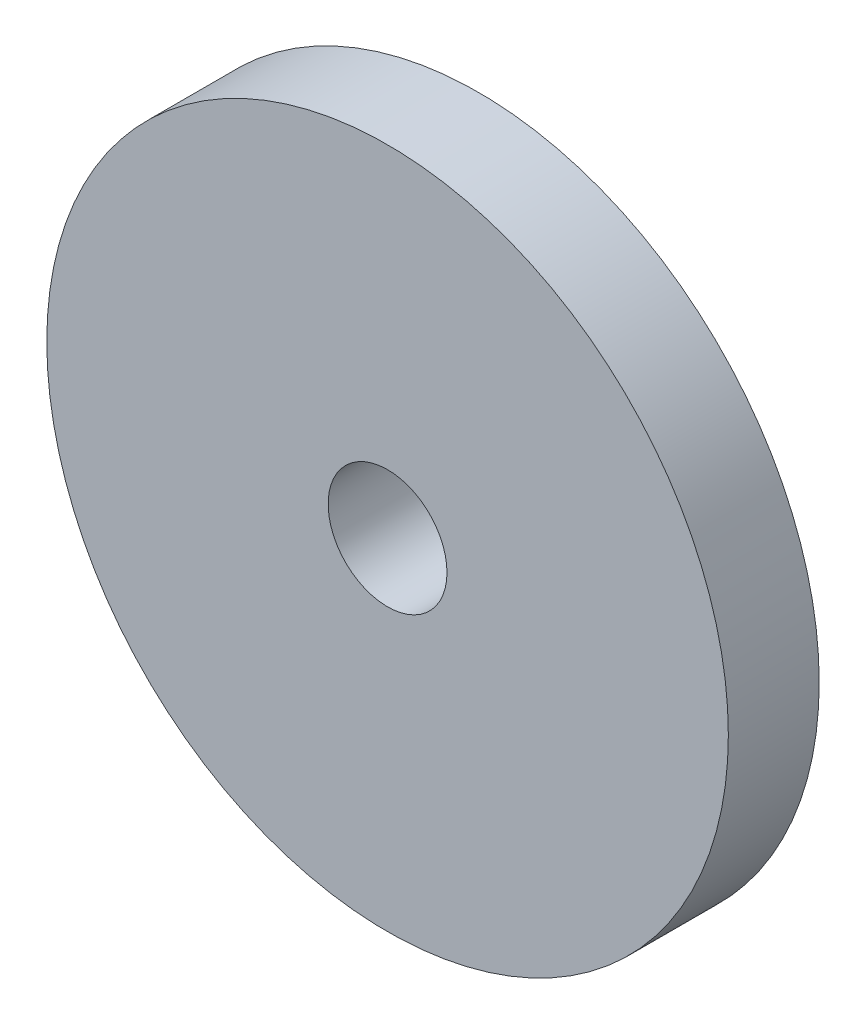
from build123d import *

# Parameters (mm, degrees)
SKETCH_1_R          = 150
SKETCH_1_R_2        = 75
SKETCH_1_R_3        = 38.1
EXTRUDE_1_DEPTH     = 40
SKETCH_1_4_R        = 75
SKETCH_1_4_R_2      = 38.1
CUT_EXTRUDE_1_DEPTH = 20
FILLET_1_R          = 3.2
SCALE_1_SCALE       = 0.4
SKETCH_3_R          = 15.813682359
SKETCH_3_R_2        = 10.461949065
EXTRUDE_2_DEPTH     = 16


with BuildPart() as part:
    # 草图1 → 凸台-拉伸1 (new body)
    # profile 1 of 2: a face of its own
    with BuildSketch(Plane.XY):
        Circle(SKETCH_1_R)
        Circle(SKETCH_1_R_2, mode=Mode.SUBTRACT)
    # profile 2 of 2: a face of its own
    with BuildSketch(Plane.XY):
        Circle(SKETCH_1_R_2)
        Circle(SKETCH_1_R_3, mode=Mode.SUBTRACT)
    extrude(amount=EXTRUDE_1_DEPTH)

    # 草图1<4> → 切除-拉伸1 (cut)
    with BuildSketch(Plane.XY):
        Circle(SKETCH_1_4_R)
        Circle(SKETCH_1_4_R_2, mode=Mode.SUBTRACT)
    extrude(amount=CUT_EXTRUDE_1_DEPTH, mode=Mode.SUBTRACT)

    # 圆角1
    fillet_1_edges = [part.edges().sort_by_distance(p)[0] for p in [
        (-75, 0, 20),
    ]]
    fillet(fillet_1_edges, radius=FILLET_1_R)


with BuildPart() as part_1:
    # 缩放比例1: scaled about (0, 0, 21.099696872)
    add(part.part.scale(SCALE_1_SCALE).moved(Location((0, 0, 12.659818123))))

    # 草图3 → 凸台-拉伸2 (add)
    with BuildSketch(Plane.XY.offset(28.659818123)):
        Circle(SKETCH_3_R)
        Circle(SKETCH_3_R_2, mode=Mode.SUBTRACT)
    extrude(amount=-EXTRUDE_2_DEPTH)


solid = part_1.part
